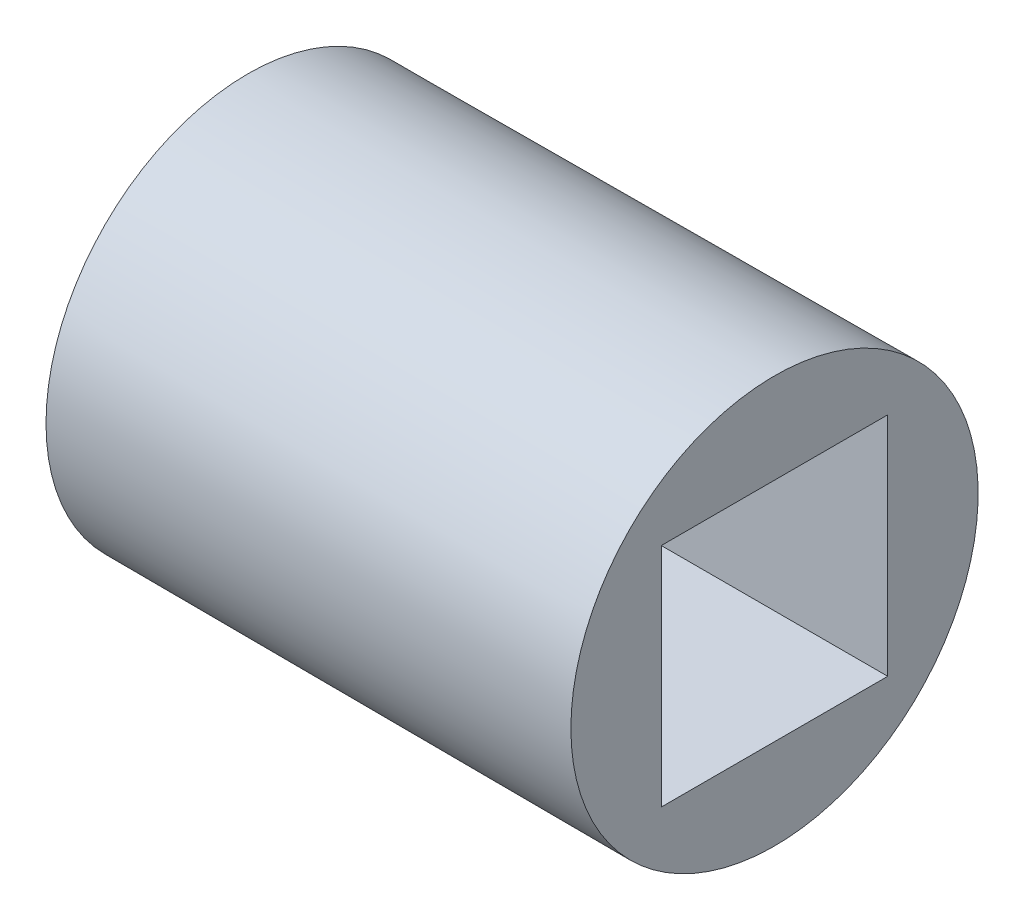
from build123d import *

# Parameters (mm, degrees)
SKETCH2_W          = 12.9
SKETCH2_H          = 12.9
CUT_EXTRUDE1_DEPTH = 25


with BuildPart() as part:
    # Sketch1 → Revolve1 (revolve)
    with BuildSketch(Plane.XY, mode=Mode.PRIVATE) as revolve1_sk:
        Polygon((-25.64984905, 0), (-25.64984905, -11.5), (4.35015095, -11.6), (4.35015095, 0), align=None)
    revolve(revolve1_sk.sketch.rotate(Axis((-25.64984905, 0, 0), (1, 0, 0)), 270), axis=Axis((-25.64984905, 0, 0), (1, 0, 0)))

    # Sketch2 → Cut-Extrude1 (cut)
    with BuildSketch(Plane(origin=(4.35015095, 0, 0), x_dir=(0, 0, -1), z_dir=(1, 0, 0))):
        Rectangle(SKETCH2_W, SKETCH2_H)
    extrude(amount=-CUT_EXTRUDE1_DEPTH, mode=Mode.SUBTRACT)


solid = part.part
